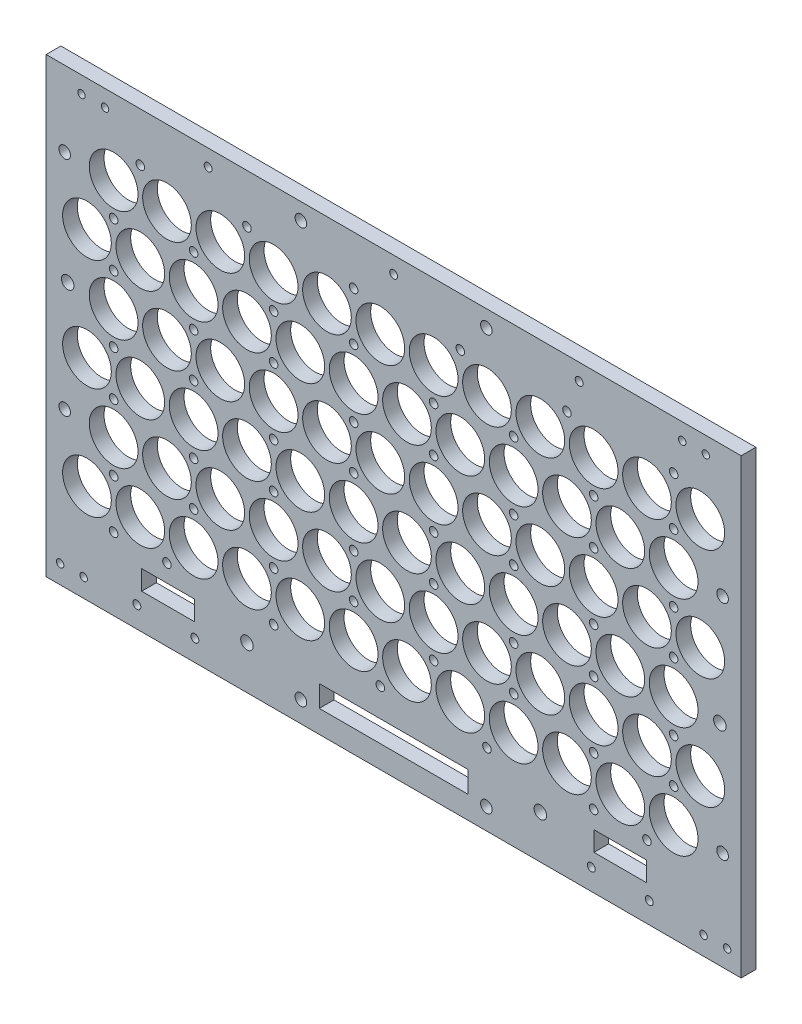
from build123d import *

# Parameters (mm, degrees)
SKETCH1_W                  = 299.700000132
SKETCH1_H                  = 194.250000104
BOSS_EXTRUDE1_DEPTH        = 6.35
SKETCH3_R                  = 10.4988
CUT_EXTRUDE1_DEPTH         = 182.719853184
SKETCH4_R                  = 10.4988
CUT_EXTRUDE2_DEPTH         = 182.719853184
LPATTERN1_COUNT            = 12
LPATTERN1_PITCH            = 23
LPATTERN2_COUNT            = 3
LPATTERN2_PITCH            = 48
LPATTERN2_COPY_1_SKETCH_R  = 10.4988
LPATTERN2_COPY_1_DEPTH     = 182.719853184
LPATTERN2_COPY_2_SKETCH_R  = 10.4988
LPATTERN2_COPY_2_DEPTH     = 182.719853184
LPATTERN2_COPY_3_SKETCH_R  = 10.4988
LPATTERN2_COPY_3_DEPTH     = 182.719853184
LPATTERN2_COPY_4_SKETCH_R  = 10.4988
LPATTERN2_COPY_4_DEPTH     = 182.719853184
LPATTERN2_COPY_5_SKETCH_R  = 10.4988
LPATTERN2_COPY_5_DEPTH     = 182.719853184
LPATTERN2_COPY_6_SKETCH_R  = 10.4988
LPATTERN2_COPY_6_DEPTH     = 182.719853184
LPATTERN2_COPY_7_SKETCH_R  = 10.4988
LPATTERN2_COPY_7_DEPTH     = 182.719853184
LPATTERN2_COPY_8_SKETCH_R  = 10.4988
LPATTERN2_COPY_8_DEPTH     = 182.719853184
LPATTERN2_COPY_9_SKETCH_R  = 10.4988
LPATTERN2_COPY_9_DEPTH     = 182.719853184
LPATTERN2_COPY_10_SKETCH_R = 10.4988
LPATTERN2_COPY_10_DEPTH    = 182.719853184
LPATTERN2_COPY_11_SKETCH_R = 10.4988
LPATTERN2_COPY_11_DEPTH    = 182.719853184
LPATTERN2_COPY_12_SKETCH_R = 10.4988
LPATTERN2_COPY_12_DEPTH    = 182.719853184
LPATTERN2_COPY_13_SKETCH_R = 10.4988
LPATTERN2_COPY_13_DEPTH    = 182.719853184
LPATTERN2_COPY_14_SKETCH_R = 10.4988
LPATTERN2_COPY_14_DEPTH    = 182.719853184
LPATTERN2_COPY_15_SKETCH_R = 10.4988
LPATTERN2_COPY_15_DEPTH    = 182.719853184
LPATTERN2_COPY_16_SKETCH_R = 10.4988
LPATTERN2_COPY_16_DEPTH    = 182.719853184
LPATTERN2_COPY_17_SKETCH_R = 10.4988
LPATTERN2_COPY_17_DEPTH    = 182.719853184
LPATTERN2_COPY_18_SKETCH_R = 10.4988
LPATTERN2_COPY_18_DEPTH    = 182.719853184
LPATTERN2_COPY_19_SKETCH_R = 10.4988
LPATTERN2_COPY_19_DEPTH    = 182.719853184
LPATTERN2_COPY_20_SKETCH_R = 10.4988
LPATTERN2_COPY_20_DEPTH    = 182.719853184
LPATTERN2_COPY_21_SKETCH_R = 10.4988
LPATTERN2_COPY_21_DEPTH    = 182.719853184
LPATTERN2_COPY_22_SKETCH_R = 10.4988
LPATTERN2_COPY_22_DEPTH    = 182.719853184
LPATTERN2_COPY_23_SKETCH_R = 10.4988
LPATTERN2_COPY_23_DEPTH    = 182.719853184
LPATTERN2_COPY_24_SKETCH_R = 10.4988
LPATTERN2_COPY_24_DEPTH    = 182.719853184
LPATTERN2_COPY_25_SKETCH_R = 10.4988
LPATTERN2_COPY_25_DEPTH    = 182.719853184
LPATTERN2_COPY_26_SKETCH_R = 10.4988
LPATTERN2_COPY_26_DEPTH    = 182.719853184
LPATTERN2_COPY_27_SKETCH_R = 10.4988
LPATTERN2_COPY_27_DEPTH    = 182.719853184
LPATTERN2_COPY_28_SKETCH_R = 10.4988
LPATTERN2_COPY_28_DEPTH    = 182.719853184
LPATTERN2_COPY_29_SKETCH_R = 10.4988
LPATTERN2_COPY_29_DEPTH    = 182.719853184
LPATTERN2_COPY_30_SKETCH_R = 10.4988
LPATTERN2_COPY_30_DEPTH    = 182.719853184
LPATTERN2_COPY_31_SKETCH_R = 10.4988
LPATTERN2_COPY_31_DEPTH    = 182.719853184
LPATTERN2_COPY_32_SKETCH_R = 10.4988
LPATTERN2_COPY_32_DEPTH    = 182.719853184
LPATTERN2_COPY_33_SKETCH_R = 10.4988
LPATTERN2_COPY_33_DEPTH    = 182.719853184
LPATTERN2_COPY_34_SKETCH_R = 10.4988
LPATTERN2_COPY_34_DEPTH    = 182.719853184
LPATTERN2_COPY_35_SKETCH_R = 10.4988
LPATTERN2_COPY_35_DEPTH    = 182.719853184
LPATTERN2_COPY_36_SKETCH_R = 10.4988
LPATTERN2_COPY_36_DEPTH    = 182.719853184
LPATTERN2_COPY_37_SKETCH_R = 10.4988
LPATTERN2_COPY_37_DEPTH    = 182.719853184
LPATTERN2_COPY_38_SKETCH_R = 10.4988
LPATTERN2_COPY_38_DEPTH    = 182.719853184
LPATTERN2_COPY_39_SKETCH_R = 10.4988
LPATTERN2_COPY_39_DEPTH    = 182.719853184
LPATTERN2_COPY_40_SKETCH_R = 10.4988
LPATTERN2_COPY_40_DEPTH    = 182.719853184
LPATTERN2_COPY_41_SKETCH_R = 10.4988
LPATTERN2_COPY_41_DEPTH    = 182.719853184
LPATTERN2_COPY_42_SKETCH_R = 10.4988
LPATTERN2_COPY_42_DEPTH    = 182.719853184
LPATTERN2_COPY_43_SKETCH_R = 10.4988
LPATTERN2_COPY_43_DEPTH    = 182.719853184
LPATTERN2_COPY_44_SKETCH_R = 10.4988
LPATTERN2_COPY_44_DEPTH    = 182.719853184
SKETCH5_W                  = 22.76
SKETCH5_H                  = 8.4615
CUT_EXTRUDE3_DEPTH         = 182.719853184
M3_CLEARANCE_HOLE1_D       = 3.2
M3_CLEARANCE_HOLE2_D       = 3.4
SKETCH14_R                 = 2.7
CUT_EXTRUDE4_DEPTH         = 182.719853184
SKETCH15_R                 = 2.5
CUT_EXTRUDE5_DEPTH         = 182.719853184
SKETCH18_R                 = 1.8415
CUT_EXTRUDE7_DEPTH         = 182.719853184
SKETCH19_W                 = 299.700000132
SKETCH19_H                 = 6.35
BOSS_EXTRUDE2_DEPTH        = 0.79375
SKETCH22_R                 = 1.8415
CUT_EXTRUDE8_DEPTH         = 182.719853184
LPATTERN3_COUNT            = 3
LPATTERN3_PITCH            = 48
SKETCH23_R                 = 1.8415
CUT_EXTRUDE9_DEPTH         = 182.719853184
LPATTERN4_COUNT            = 2
LPATTERN4_PITCH            = 48
LPATTERN5_COUNT            = 4
LPATTERN5_PITCH            = 69
LPATTERN5_COPY_1_SKETCH_R  = 1.8415
LPATTERN5_COPY_1_DEPTH     = 182.719853184
LPATTERN5_COPY_2_SKETCH_R  = 1.8415
LPATTERN5_COPY_2_DEPTH     = 182.719853184
LPATTERN5_COPY_3_SKETCH_R  = 1.8415
LPATTERN5_COPY_3_DEPTH     = 182.719853184
LPATTERN5_COPY_4_SKETCH_R  = 1.8415
LPATTERN5_COPY_4_DEPTH     = 182.719853184
LPATTERN5_COPY_5_SKETCH_R  = 1.8415
LPATTERN5_COPY_5_DEPTH     = 182.719853184
LPATTERN5_COPY_6_SKETCH_R  = 1.8415
LPATTERN5_COPY_6_DEPTH     = 182.719853184
LPATTERN5_COPY_7_SKETCH_R  = 1.8415
LPATTERN5_COPY_7_DEPTH     = 182.719853184
LPATTERN5_COPY_8_SKETCH_R  = 1.8415
LPATTERN5_COPY_8_DEPTH     = 182.719853184
LPATTERN5_COPY_9_SKETCH_R  = 1.8415
LPATTERN5_COPY_9_DEPTH     = 182.719853184
M3_CLEARANCE_HOLE3_D       = 3.4
SKETCH31_W                 = 64.135
SKETCH31_H                 = 9.275
CUT_EXTRUDE10_DEPTH        = 182.719853184


with BuildPart() as part:
    # Sketch1 → Boss-Extrude1 (new body)
    with BuildSketch(Plane.XY):
        with Locations((0, -5.475000052)):
            Rectangle(SKETCH1_W, SKETCH1_H)
    extrude(amount=BOSS_EXTRUDE1_DEPTH)

    # Sketch3 → Cut-Extrude1 (cut, through all)
    with BuildSketch(Plane.XY.offset(6.35)):
        with Locations((-132.25, -60)):
            Circle(SKETCH3_R)
    cut_extrude1 = extrude(amount=-CUT_EXTRUDE1_DEPTH, mode=Mode.SUBTRACT)

    # Sketch4 → Cut-Extrude2 (cut, through all)
    with BuildSketch(Plane.XY.offset(6.35)):
        with Locations((-120.75, -36)):
            Circle(SKETCH4_R)
    cut_extrude2 = extrude(amount=-CUT_EXTRUDE2_DEPTH, mode=Mode.SUBTRACT)

    # LPattern1: Cut-Extrude1, Cut-Extrude2 ×12
    with Locations(*[(i * LPATTERN1_PITCH, 0, 0) for i in range(1, LPATTERN1_COUNT)]):
        add(cut_extrude1, mode=Mode.SUBTRACT)
        add(cut_extrude2, mode=Mode.SUBTRACT)

    # LPattern2: Cut-Extrude1, Cut-Extrude2 ×3
    with Locations(*[(0, i * LPATTERN2_PITCH, 0) for i in range(1, LPATTERN2_COUNT)]):
        add(cut_extrude1, mode=Mode.SUBTRACT)
        add(cut_extrude2, mode=Mode.SUBTRACT)

    # LPattern2 copy 1 sketch → LPattern2 copy 1 (cut, through all)
    with BuildSketch(Plane(origin=(23, 48, 6.35), x_dir=(1, 0, 0), z_dir=(0, 0, 1))):
        with Locations((-132.25, -60)):
            Circle(LPATTERN2_COPY_1_SKETCH_R)
    extrude(amount=-LPATTERN2_COPY_1_DEPTH, mode=Mode.SUBTRACT)

    # LPattern2 copy 2 sketch → LPattern2 copy 2 (cut, through all)
    with BuildSketch(Plane(origin=(23, 96, 6.35), x_dir=(1, 0, 0), z_dir=(0, 0, 1))):
        with Locations((-132.25, -60)):
            Circle(LPATTERN2_COPY_2_SKETCH_R)
    extrude(amount=-LPATTERN2_COPY_2_DEPTH, mode=Mode.SUBTRACT)

    # LPattern2 copy 3 sketch → LPattern2 copy 3 (cut, through all)
    with BuildSketch(Plane(origin=(46, 48, 6.35), x_dir=(1, 0, 0), z_dir=(0, 0, 1))):
        with Locations((-132.25, -60)):
            Circle(LPATTERN2_COPY_3_SKETCH_R)
    extrude(amount=-LPATTERN2_COPY_3_DEPTH, mode=Mode.SUBTRACT)

    # LPattern2 copy 4 sketch → LPattern2 copy 4 (cut, through all)
    with BuildSketch(Plane(origin=(46, 96, 6.35), x_dir=(1, 0, 0), z_dir=(0, 0, 1))):
        with Locations((-132.25, -60)):
            Circle(LPATTERN2_COPY_4_SKETCH_R)
    extrude(amount=-LPATTERN2_COPY_4_DEPTH, mode=Mode.SUBTRACT)

    # LPattern2 copy 5 sketch → LPattern2 copy 5 (cut, through all)
    with BuildSketch(Plane(origin=(69, 48, 6.35), x_dir=(1, 0, 0), z_dir=(0, 0, 1))):
        with Locations((-132.25, -60)):
            Circle(LPATTERN2_COPY_5_SKETCH_R)
    extrude(amount=-LPATTERN2_COPY_5_DEPTH, mode=Mode.SUBTRACT)

    # LPattern2 copy 6 sketch → LPattern2 copy 6 (cut, through all)
    with BuildSketch(Plane(origin=(69, 96, 6.35), x_dir=(1, 0, 0), z_dir=(0, 0, 1))):
        with Locations((-132.25, -60)):
            Circle(LPATTERN2_COPY_6_SKETCH_R)
    extrude(amount=-LPATTERN2_COPY_6_DEPTH, mode=Mode.SUBTRACT)

    # LPattern2 copy 7 sketch → LPattern2 copy 7 (cut, through all)
    with BuildSketch(Plane(origin=(92, 48, 6.35), x_dir=(1, 0, 0), z_dir=(0, 0, 1))):
        with Locations((-132.25, -60)):
            Circle(LPATTERN2_COPY_7_SKETCH_R)
    extrude(amount=-LPATTERN2_COPY_7_DEPTH, mode=Mode.SUBTRACT)

    # LPattern2 copy 8 sketch → LPattern2 copy 8 (cut, through all)
    with BuildSketch(Plane(origin=(92, 96, 6.35), x_dir=(1, 0, 0), z_dir=(0, 0, 1))):
        with Locations((-132.25, -60)):
            Circle(LPATTERN2_COPY_8_SKETCH_R)
    extrude(amount=-LPATTERN2_COPY_8_DEPTH, mode=Mode.SUBTRACT)

    # LPattern2 copy 9 sketch → LPattern2 copy 9 (cut, through all)
    with BuildSketch(Plane(origin=(115, 48, 6.35), x_dir=(1, 0, 0), z_dir=(0, 0, 1))):
        with Locations((-132.25, -60)):
            Circle(LPATTERN2_COPY_9_SKETCH_R)
    extrude(amount=-LPATTERN2_COPY_9_DEPTH, mode=Mode.SUBTRACT)

    # LPattern2 copy 10 sketch → LPattern2 copy 10 (cut, through all)
    with BuildSketch(Plane(origin=(115, 96, 6.35), x_dir=(1, 0, 0), z_dir=(0, 0, 1))):
        with Locations((-132.25, -60)):
            Circle(LPATTERN2_COPY_10_SKETCH_R)
    extrude(amount=-LPATTERN2_COPY_10_DEPTH, mode=Mode.SUBTRACT)

    # LPattern2 copy 11 sketch → LPattern2 copy 11 (cut, through all)
    with BuildSketch(Plane(origin=(138, 48, 6.35), x_dir=(1, 0, 0), z_dir=(0, 0, 1))):
        with Locations((-132.25, -60)):
            Circle(LPATTERN2_COPY_11_SKETCH_R)
    extrude(amount=-LPATTERN2_COPY_11_DEPTH, mode=Mode.SUBTRACT)

    # LPattern2 copy 12 sketch → LPattern2 copy 12 (cut, through all)
    with BuildSketch(Plane(origin=(138, 96, 6.35), x_dir=(1, 0, 0), z_dir=(0, 0, 1))):
        with Locations((-132.25, -60)):
            Circle(LPATTERN2_COPY_12_SKETCH_R)
    extrude(amount=-LPATTERN2_COPY_12_DEPTH, mode=Mode.SUBTRACT)

    # LPattern2 copy 13 sketch → LPattern2 copy 13 (cut, through all)
    with BuildSketch(Plane(origin=(161, 48, 6.35), x_dir=(1, 0, 0), z_dir=(0, 0, 1))):
        with Locations((-132.25, -60)):
            Circle(LPATTERN2_COPY_13_SKETCH_R)
    extrude(amount=-LPATTERN2_COPY_13_DEPTH, mode=Mode.SUBTRACT)

    # LPattern2 copy 14 sketch → LPattern2 copy 14 (cut, through all)
    with BuildSketch(Plane(origin=(161, 96, 6.35), x_dir=(1, 0, 0), z_dir=(0, 0, 1))):
        with Locations((-132.25, -60)):
            Circle(LPATTERN2_COPY_14_SKETCH_R)
    extrude(amount=-LPATTERN2_COPY_14_DEPTH, mode=Mode.SUBTRACT)

    # LPattern2 copy 15 sketch → LPattern2 copy 15 (cut, through all)
    with BuildSketch(Plane(origin=(184, 48, 6.35), x_dir=(1, 0, 0), z_dir=(0, 0, 1))):
        with Locations((-132.25, -60)):
            Circle(LPATTERN2_COPY_15_SKETCH_R)
    extrude(amount=-LPATTERN2_COPY_15_DEPTH, mode=Mode.SUBTRACT)

    # LPattern2 copy 16 sketch → LPattern2 copy 16 (cut, through all)
    with BuildSketch(Plane(origin=(184, 96, 6.35), x_dir=(1, 0, 0), z_dir=(0, 0, 1))):
        with Locations((-132.25, -60)):
            Circle(LPATTERN2_COPY_16_SKETCH_R)
    extrude(amount=-LPATTERN2_COPY_16_DEPTH, mode=Mode.SUBTRACT)

    # LPattern2 copy 17 sketch → LPattern2 copy 17 (cut, through all)
    with BuildSketch(Plane(origin=(207, 48, 6.35), x_dir=(1, 0, 0), z_dir=(0, 0, 1))):
        with Locations((-132.25, -60)):
            Circle(LPATTERN2_COPY_17_SKETCH_R)
    extrude(amount=-LPATTERN2_COPY_17_DEPTH, mode=Mode.SUBTRACT)

    # LPattern2 copy 18 sketch → LPattern2 copy 18 (cut, through all)
    with BuildSketch(Plane(origin=(207, 96, 6.35), x_dir=(1, 0, 0), z_dir=(0, 0, 1))):
        with Locations((-132.25, -60)):
            Circle(LPATTERN2_COPY_18_SKETCH_R)
    extrude(amount=-LPATTERN2_COPY_18_DEPTH, mode=Mode.SUBTRACT)

    # LPattern2 copy 19 sketch → LPattern2 copy 19 (cut, through all)
    with BuildSketch(Plane(origin=(230, 48, 6.35), x_dir=(1, 0, 0), z_dir=(0, 0, 1))):
        with Locations((-132.25, -60)):
            Circle(LPATTERN2_COPY_19_SKETCH_R)
    extrude(amount=-LPATTERN2_COPY_19_DEPTH, mode=Mode.SUBTRACT)

    # LPattern2 copy 20 sketch → LPattern2 copy 20 (cut, through all)
    with BuildSketch(Plane(origin=(230, 96, 6.35), x_dir=(1, 0, 0), z_dir=(0, 0, 1))):
        with Locations((-132.25, -60)):
            Circle(LPATTERN2_COPY_20_SKETCH_R)
    extrude(amount=-LPATTERN2_COPY_20_DEPTH, mode=Mode.SUBTRACT)

    # LPattern2 copy 21 sketch → LPattern2 copy 21 (cut, through all)
    with BuildSketch(Plane(origin=(253, 48, 6.35), x_dir=(1, 0, 0), z_dir=(0, 0, 1))):
        with Locations((-132.25, -60)):
            Circle(LPATTERN2_COPY_21_SKETCH_R)
    extrude(amount=-LPATTERN2_COPY_21_DEPTH, mode=Mode.SUBTRACT)

    # LPattern2 copy 22 sketch → LPattern2 copy 22 (cut, through all)
    with BuildSketch(Plane(origin=(253, 96, 6.35), x_dir=(1, 0, 0), z_dir=(0, 0, 1))):
        with Locations((-132.25, -60)):
            Circle(LPATTERN2_COPY_22_SKETCH_R)
    extrude(amount=-LPATTERN2_COPY_22_DEPTH, mode=Mode.SUBTRACT)

    # LPattern2 copy 23 sketch → LPattern2 copy 23 (cut, through all)
    with BuildSketch(Plane(origin=(23, 48, 6.35), x_dir=(1, 0, 0), z_dir=(0, 0, 1))):
        with Locations((-120.75, -36)):
            Circle(LPATTERN2_COPY_23_SKETCH_R)
    extrude(amount=-LPATTERN2_COPY_23_DEPTH, mode=Mode.SUBTRACT)

    # LPattern2 copy 24 sketch → LPattern2 copy 24 (cut, through all)
    with BuildSketch(Plane(origin=(23, 96, 6.35), x_dir=(1, 0, 0), z_dir=(0, 0, 1))):
        with Locations((-120.75, -36)):
            Circle(LPATTERN2_COPY_24_SKETCH_R)
    extrude(amount=-LPATTERN2_COPY_24_DEPTH, mode=Mode.SUBTRACT)

    # LPattern2 copy 25 sketch → LPattern2 copy 25 (cut, through all)
    with BuildSketch(Plane(origin=(46, 48, 6.35), x_dir=(1, 0, 0), z_dir=(0, 0, 1))):
        with Locations((-120.75, -36)):
            Circle(LPATTERN2_COPY_25_SKETCH_R)
    extrude(amount=-LPATTERN2_COPY_25_DEPTH, mode=Mode.SUBTRACT)

    # LPattern2 copy 26 sketch → LPattern2 copy 26 (cut, through all)
    with BuildSketch(Plane(origin=(46, 96, 6.35), x_dir=(1, 0, 0), z_dir=(0, 0, 1))):
        with Locations((-120.75, -36)):
            Circle(LPATTERN2_COPY_26_SKETCH_R)
    extrude(amount=-LPATTERN2_COPY_26_DEPTH, mode=Mode.SUBTRACT)

    # LPattern2 copy 27 sketch → LPattern2 copy 27 (cut, through all)
    with BuildSketch(Plane(origin=(69, 48, 6.35), x_dir=(1, 0, 0), z_dir=(0, 0, 1))):
        with Locations((-120.75, -36)):
            Circle(LPATTERN2_COPY_27_SKETCH_R)
    extrude(amount=-LPATTERN2_COPY_27_DEPTH, mode=Mode.SUBTRACT)

    # LPattern2 copy 28 sketch → LPattern2 copy 28 (cut, through all)
    with BuildSketch(Plane(origin=(69, 96, 6.35), x_dir=(1, 0, 0), z_dir=(0, 0, 1))):
        with Locations((-120.75, -36)):
            Circle(LPATTERN2_COPY_28_SKETCH_R)
    extrude(amount=-LPATTERN2_COPY_28_DEPTH, mode=Mode.SUBTRACT)

    # LPattern2 copy 29 sketch → LPattern2 copy 29 (cut, through all)
    with BuildSketch(Plane(origin=(92, 48, 6.35), x_dir=(1, 0, 0), z_dir=(0, 0, 1))):
        with Locations((-120.75, -36)):
            Circle(LPATTERN2_COPY_29_SKETCH_R)
    extrude(amount=-LPATTERN2_COPY_29_DEPTH, mode=Mode.SUBTRACT)

    # LPattern2 copy 30 sketch → LPattern2 copy 30 (cut, through all)
    with BuildSketch(Plane(origin=(92, 96, 6.35), x_dir=(1, 0, 0), z_dir=(0, 0, 1))):
        with Locations((-120.75, -36)):
            Circle(LPATTERN2_COPY_30_SKETCH_R)
    extrude(amount=-LPATTERN2_COPY_30_DEPTH, mode=Mode.SUBTRACT)

    # LPattern2 copy 31 sketch → LPattern2 copy 31 (cut, through all)
    with BuildSketch(Plane(origin=(115, 48, 6.35), x_dir=(1, 0, 0), z_dir=(0, 0, 1))):
        with Locations((-120.75, -36)):
            Circle(LPATTERN2_COPY_31_SKETCH_R)
    extrude(amount=-LPATTERN2_COPY_31_DEPTH, mode=Mode.SUBTRACT)

    # LPattern2 copy 32 sketch → LPattern2 copy 32 (cut, through all)
    with BuildSketch(Plane(origin=(115, 96, 6.35), x_dir=(1, 0, 0), z_dir=(0, 0, 1))):
        with Locations((-120.75, -36)):
            Circle(LPATTERN2_COPY_32_SKETCH_R)
    extrude(amount=-LPATTERN2_COPY_32_DEPTH, mode=Mode.SUBTRACT)

    # LPattern2 copy 33 sketch → LPattern2 copy 33 (cut, through all)
    with BuildSketch(Plane(origin=(138, 48, 6.35), x_dir=(1, 0, 0), z_dir=(0, 0, 1))):
        with Locations((-120.75, -36)):
            Circle(LPATTERN2_COPY_33_SKETCH_R)
    extrude(amount=-LPATTERN2_COPY_33_DEPTH, mode=Mode.SUBTRACT)

    # LPattern2 copy 34 sketch → LPattern2 copy 34 (cut, through all)
    with BuildSketch(Plane(origin=(138, 96, 6.35), x_dir=(1, 0, 0), z_dir=(0, 0, 1))):
        with Locations((-120.75, -36)):
            Circle(LPATTERN2_COPY_34_SKETCH_R)
    extrude(amount=-LPATTERN2_COPY_34_DEPTH, mode=Mode.SUBTRACT)

    # LPattern2 copy 35 sketch → LPattern2 copy 35 (cut, through all)
    with BuildSketch(Plane(origin=(161, 48, 6.35), x_dir=(1, 0, 0), z_dir=(0, 0, 1))):
        with Locations((-120.75, -36)):
            Circle(LPATTERN2_COPY_35_SKETCH_R)
    extrude(amount=-LPATTERN2_COPY_35_DEPTH, mode=Mode.SUBTRACT)

    # LPattern2 copy 36 sketch → LPattern2 copy 36 (cut, through all)
    with BuildSketch(Plane(origin=(161, 96, 6.35), x_dir=(1, 0, 0), z_dir=(0, 0, 1))):
        with Locations((-120.75, -36)):
            Circle(LPATTERN2_COPY_36_SKETCH_R)
    extrude(amount=-LPATTERN2_COPY_36_DEPTH, mode=Mode.SUBTRACT)

    # LPattern2 copy 37 sketch → LPattern2 copy 37 (cut, through all)
    with BuildSketch(Plane(origin=(184, 48, 6.35), x_dir=(1, 0, 0), z_dir=(0, 0, 1))):
        with Locations((-120.75, -36)):
            Circle(LPATTERN2_COPY_37_SKETCH_R)
    extrude(amount=-LPATTERN2_COPY_37_DEPTH, mode=Mode.SUBTRACT)

    # LPattern2 copy 38 sketch → LPattern2 copy 38 (cut, through all)
    with BuildSketch(Plane(origin=(184, 96, 6.35), x_dir=(1, 0, 0), z_dir=(0, 0, 1))):
        with Locations((-120.75, -36)):
            Circle(LPATTERN2_COPY_38_SKETCH_R)
    extrude(amount=-LPATTERN2_COPY_38_DEPTH, mode=Mode.SUBTRACT)

    # LPattern2 copy 39 sketch → LPattern2 copy 39 (cut, through all)
    with BuildSketch(Plane(origin=(207, 48, 6.35), x_dir=(1, 0, 0), z_dir=(0, 0, 1))):
        with Locations((-120.75, -36)):
            Circle(LPATTERN2_COPY_39_SKETCH_R)
    extrude(amount=-LPATTERN2_COPY_39_DEPTH, mode=Mode.SUBTRACT)

    # LPattern2 copy 40 sketch → LPattern2 copy 40 (cut, through all)
    with BuildSketch(Plane(origin=(207, 96, 6.35), x_dir=(1, 0, 0), z_dir=(0, 0, 1))):
        with Locations((-120.75, -36)):
            Circle(LPATTERN2_COPY_40_SKETCH_R)
    extrude(amount=-LPATTERN2_COPY_40_DEPTH, mode=Mode.SUBTRACT)

    # LPattern2 copy 41 sketch → LPattern2 copy 41 (cut, through all)
    with BuildSketch(Plane(origin=(230, 48, 6.35), x_dir=(1, 0, 0), z_dir=(0, 0, 1))):
        with Locations((-120.75, -36)):
            Circle(LPATTERN2_COPY_41_SKETCH_R)
    extrude(amount=-LPATTERN2_COPY_41_DEPTH, mode=Mode.SUBTRACT)

    # LPattern2 copy 42 sketch → LPattern2 copy 42 (cut, through all)
    with BuildSketch(Plane(origin=(230, 96, 6.35), x_dir=(1, 0, 0), z_dir=(0, 0, 1))):
        with Locations((-120.75, -36)):
            Circle(LPATTERN2_COPY_42_SKETCH_R)
    extrude(amount=-LPATTERN2_COPY_42_DEPTH, mode=Mode.SUBTRACT)

    # LPattern2 copy 43 sketch → LPattern2 copy 43 (cut, through all)
    with BuildSketch(Plane(origin=(253, 48, 6.35), x_dir=(1, 0, 0), z_dir=(0, 0, 1))):
        with Locations((-120.75, -36)):
            Circle(LPATTERN2_COPY_43_SKETCH_R)
    extrude(amount=-LPATTERN2_COPY_43_DEPTH, mode=Mode.SUBTRACT)

    # LPattern2 copy 44 sketch → LPattern2 copy 44 (cut, through all)
    with BuildSketch(Plane(origin=(253, 96, 6.35), x_dir=(1, 0, 0), z_dir=(0, 0, 1))):
        with Locations((-120.75, -36)):
            Circle(LPATTERN2_COPY_44_SKETCH_R)
    extrude(amount=-LPATTERN2_COPY_44_DEPTH, mode=Mode.SUBTRACT)

    # Sketch5 → Cut-Extrude3 (cut, through all)
    # profile 1 of 4: a face of its own
    with BuildSketch(Plane.XY.offset(6.35)):
        with Locations((97.75, -83.18075)):
            Rectangle(SKETCH5_W, SKETCH5_H)
        with BuildLine():
            Line((90.18464302, -79.3475), (105.31535698, -79.3475))
            ThreePointArc((105.31535698, -79.3475), (105.176769839, -79.814816153), (105.13, -80.3))
            Line((105.13, -80.3), (105.13, -83.4115))
            Line((105.13, -83.4115), (90.37, -83.4115))
            Line((90.37, -83.4115), (90.37, -80.3))
            ThreePointArc((90.37, -80.3), (90.323230161, -79.814816153), (90.18464302, -79.3475))
        make_face(mode=Mode.SUBTRACT)
    # profile 2 of 4: a face of its own
    with BuildSketch(Plane.XY.offset(6.35)):
        with BuildLine():
            ThreePointArc((105.31535698, -79.3475), (105.176769839, -79.814816153), (105.13, -80.3))
            Line((105.13, -80.3), (105.13, -83.4115))
            Line((105.13, -83.4115), (90.37, -83.4115))
            Line((90.37, -83.4115), (90.37, -80.3))
            ThreePointArc((90.37, -80.3), (90.323230161, -79.814816153), (90.18464302, -79.3475))
            Line((90.18464302, -79.3475), (105.31535698, -79.3475))
        make_face()
    # profile 3 of 4: a face of its own
    with BuildSketch(Plane.XY.offset(6.35)):
        with Locations((-97.288, -83.18075)):
            Rectangle(SKETCH5_W, SKETCH5_H)
        with BuildLine():
            Line((-104.85335698, -79.3475), (-89.72264302, -79.3475))
            ThreePointArc((-89.72264302, -79.3475), (-89.861230161, -79.814816153), (-89.908, -80.3))
            Line((-89.908, -80.3), (-89.908, -83.4115))
            Line((-89.908, -83.4115), (-104.668, -83.4115))
            Line((-104.668, -83.4115), (-104.668, -80.3))
            ThreePointArc((-104.668, -80.3), (-104.714769839, -79.814816153), (-104.85335698, -79.3475))
        make_face(mode=Mode.SUBTRACT)
    # profile 4 of 4: a face of its own
    with BuildSketch(Plane.XY.offset(6.35)):
        with BuildLine():
            ThreePointArc((-89.72264302, -79.3475), (-89.861230161, -79.814816153), (-89.908, -80.3))
            Line((-89.908, -80.3), (-89.908, -83.4115))
            Line((-89.908, -83.4115), (-104.668, -83.4115))
            Line((-104.668, -83.4115), (-104.668, -80.3))
            ThreePointArc((-104.668, -80.3), (-104.714769839, -79.814816153), (-104.85335698, -79.3475))
            Line((-104.85335698, -79.3475), (-89.72264302, -79.3475))
        make_face()
    extrude(amount=-CUT_EXTRUDE3_DEPTH, mode=Mode.SUBTRACT)

    # M3 Clearance Hole1 (through all)
    with Locations(Plane.XY.offset(6.35)):
        with Locations((124.450000066, 85.3), (134.610000066, 85.3), (-124.450000066, 85.3), (-134.610000066, 85.3), (-143.817500066, -94.6000001), (-133.657500066, -94.6000001), (133.657500066, -94.6000001), (143.817500066, -94.6000001)):
            Hole(M3_CLEARANCE_HOLE1_D / 2)

    # M3 Clearance Hole2 (through all)
    with Locations(Plane.XY.offset(6.35)):
        with Locations((110.25, -93.50575), (85.25, -93.50575), (-80, 85.3), (0, 85.3), (80, 85.3)):
            Hole(M3_CLEARANCE_HOLE2_D / 2)

    # Sketch14 → Cut-Extrude4 (cut, through all)
    with BuildSketch(Plane.XY.offset(6.35)):
        with Locations((-63.25, -83.95)):
            Circle(SKETCH14_R)
        with Locations((63.25, -83.95)):
            Circle(SKETCH14_R)
        with Locations((-140.549400033, 12)):
            Circle(SKETCH14_R)
        with Locations((140.687500033, -12)):
            Circle(SKETCH14_R)
    extrude(amount=-CUT_EXTRUDE4_DEPTH, mode=Mode.SUBTRACT)

    # Sketch15 → Cut-Extrude5 (cut, through all)
    with BuildSketch(Plane.XY.offset(6.35)):
        with Locations((-40, 85.3)):
            Circle(SKETCH15_R)
        with Locations((40, 85.3)):
            Circle(SKETCH15_R)
        with Locations((141.850000066, 36)):
            Circle(SKETCH15_R)
        with Locations((141.850000066, -60)):
            Circle(SKETCH15_R)
        with Locations((-141.850000066, -36)):
            Circle(SKETCH15_R)
        with Locations((-141.850000066, 60)):
            Circle(SKETCH15_R)
        with Locations((-40, -93.50575)):
            Circle(SKETCH15_R)
        with Locations((40, -93.50575)):
            Circle(SKETCH15_R)
    extrude(amount=-CUT_EXTRUDE5_DEPTH, mode=Mode.SUBTRACT)

    # Sketch18 → Cut-Extrude7 (cut, through all)
    with BuildSketch(Plane.XY.offset(6.35)):
        with Locations((109.25, -71.41)):
            Circle(SKETCH18_R)
        with Locations((86.25, -71.41)):
            Circle(SKETCH18_R)
        with Locations((120.75, 71.41)):
            Circle(SKETCH18_R)
        with Locations((74.75, 71.41)):
            Circle(SKETCH18_R)
        with Locations((28.75, 71.41)):
            Circle(SKETCH18_R)
        with Locations((-17.25, 71.41)):
            Circle(SKETCH18_R)
        with Locations((-63.25, 71.41)):
            Circle(SKETCH18_R)
        with Locations((-109.25, 71.41)):
            Circle(SKETCH18_R)
        with Locations((40.25, -71.41)):
            Circle(SKETCH18_R)
        with Locations((-5.75, -71.41)):
            Circle(SKETCH18_R)
        with Locations((-51.75, -71.41)):
            Circle(SKETCH18_R)
        with Locations((-97.75, -71.41)):
            Circle(SKETCH18_R)
        with Locations((-120.75, -71.41)):
            Circle(SKETCH18_R)
    extrude(amount=-CUT_EXTRUDE7_DEPTH, mode=Mode.SUBTRACT)

    # Sketch19 → Boss-Extrude2 (add)
    with BuildSketch(Plane(origin=(0, 91.65, 0), x_dir=(1, 0, 0), z_dir=(0, 1, 0))):
        with Locations((0, -3.175)):
            Rectangle(SKETCH19_W, SKETCH19_H)
    extrude(amount=BOSS_EXTRUDE2_DEPTH)

    # Sketch22 → Cut-Extrude8 (cut, through all)
    with BuildSketch(Plane.XY.offset(6.35)):
        with Locations((120.75, -45.467986122)):
            Circle(SKETCH22_R)
        with Locations((86.25, -50.28293229)):
            Circle(SKETCH22_R)
    cut_extrude8 = extrude(amount=-CUT_EXTRUDE8_DEPTH, mode=Mode.SUBTRACT)

    # LPattern3: Cut-Extrude8 ×3
    with Locations(*[(0, i * LPATTERN3_PITCH, 0) for i in range(1, LPATTERN3_COUNT)]):
        add(cut_extrude8, mode=Mode.SUBTRACT)

    # Sketch23 → Cut-Extrude9 (cut, through all)
    with BuildSketch(Plane.XY.offset(6.35)):
        with Locations((86.25, -21.71706771)):
            Circle(SKETCH23_R)
        with Locations((120.75, -26.532013878)):
            Circle(SKETCH23_R)
    cut_extrude9 = extrude(amount=-CUT_EXTRUDE9_DEPTH, mode=Mode.SUBTRACT)

    # LPattern4: Cut-Extrude9 ×2
    with Locations(*[(0, i * LPATTERN4_PITCH, 0) for i in range(1, LPATTERN4_COUNT)]):
        add(cut_extrude9, mode=Mode.SUBTRACT)

    # LPattern5: Cut-Extrude8, Cut-Extrude9 ×4
    with Locations(*[(-i * LPATTERN5_PITCH, 0, 0) for i in range(1, LPATTERN5_COUNT)]):
        add(cut_extrude8, mode=Mode.SUBTRACT)
        add(cut_extrude9, mode=Mode.SUBTRACT)

    # LPattern5 copy 1 sketch → LPattern5 copy 1 (cut, through all)
    with BuildSketch(Plane(origin=(-69, 48, 6.35), x_dir=(1, 0, 0), z_dir=(0, 0, 1))):
        with Locations((120.75, -45.467986122)):
            Circle(LPATTERN5_COPY_1_SKETCH_R)
        with Locations((86.25, -50.28293229)):
            Circle(LPATTERN5_COPY_1_SKETCH_R)
    extrude(amount=-LPATTERN5_COPY_1_DEPTH, mode=Mode.SUBTRACT)

    # LPattern5 copy 2 sketch → LPattern5 copy 2 (cut, through all)
    with BuildSketch(Plane(origin=(-138, 48, 6.35), x_dir=(1, 0, 0), z_dir=(0, 0, 1))):
        with Locations((120.75, -45.467986122)):
            Circle(LPATTERN5_COPY_2_SKETCH_R)
        with Locations((86.25, -50.28293229)):
            Circle(LPATTERN5_COPY_2_SKETCH_R)
    extrude(amount=-LPATTERN5_COPY_2_DEPTH, mode=Mode.SUBTRACT)

    # LPattern5 copy 3 sketch → LPattern5 copy 3 (cut, through all)
    with BuildSketch(Plane(origin=(-207, 48, 6.35), x_dir=(1, 0, 0), z_dir=(0, 0, 1))):
        with Locations((120.75, -45.467986122)):
            Circle(LPATTERN5_COPY_3_SKETCH_R)
        with Locations((86.25, -50.28293229)):
            Circle(LPATTERN5_COPY_3_SKETCH_R)
    extrude(amount=-LPATTERN5_COPY_3_DEPTH, mode=Mode.SUBTRACT)

    # LPattern5 copy 4 sketch → LPattern5 copy 4 (cut, through all)
    with BuildSketch(Plane(origin=(-69, 96, 6.35), x_dir=(1, 0, 0), z_dir=(0, 0, 1))):
        with Locations((120.75, -45.467986122)):
            Circle(LPATTERN5_COPY_4_SKETCH_R)
        with Locations((86.25, -50.28293229)):
            Circle(LPATTERN5_COPY_4_SKETCH_R)
    extrude(amount=-LPATTERN5_COPY_4_DEPTH, mode=Mode.SUBTRACT)

    # LPattern5 copy 5 sketch → LPattern5 copy 5 (cut, through all)
    with BuildSketch(Plane(origin=(-138, 96, 6.35), x_dir=(1, 0, 0), z_dir=(0, 0, 1))):
        with Locations((120.75, -45.467986122)):
            Circle(LPATTERN5_COPY_5_SKETCH_R)
        with Locations((86.25, -50.28293229)):
            Circle(LPATTERN5_COPY_5_SKETCH_R)
    extrude(amount=-LPATTERN5_COPY_5_DEPTH, mode=Mode.SUBTRACT)

    # LPattern5 copy 6 sketch → LPattern5 copy 6 (cut, through all)
    with BuildSketch(Plane(origin=(-207, 96, 6.35), x_dir=(1, 0, 0), z_dir=(0, 0, 1))):
        with Locations((120.75, -45.467986122)):
            Circle(LPATTERN5_COPY_6_SKETCH_R)
        with Locations((86.25, -50.28293229)):
            Circle(LPATTERN5_COPY_6_SKETCH_R)
    extrude(amount=-LPATTERN5_COPY_6_DEPTH, mode=Mode.SUBTRACT)

    # LPattern5 copy 7 sketch → LPattern5 copy 7 (cut, through all)
    with BuildSketch(Plane(origin=(-69, 48, 6.35), x_dir=(1, 0, 0), z_dir=(0, 0, 1))):
        with Locations((86.25, -21.71706771)):
            Circle(LPATTERN5_COPY_7_SKETCH_R)
        with Locations((120.75, -26.532013878)):
            Circle(LPATTERN5_COPY_7_SKETCH_R)
    extrude(amount=-LPATTERN5_COPY_7_DEPTH, mode=Mode.SUBTRACT)

    # LPattern5 copy 8 sketch → LPattern5 copy 8 (cut, through all)
    with BuildSketch(Plane(origin=(-138, 48, 6.35), x_dir=(1, 0, 0), z_dir=(0, 0, 1))):
        with Locations((86.25, -21.71706771)):
            Circle(LPATTERN5_COPY_8_SKETCH_R)
        with Locations((120.75, -26.532013878)):
            Circle(LPATTERN5_COPY_8_SKETCH_R)
    extrude(amount=-LPATTERN5_COPY_8_DEPTH, mode=Mode.SUBTRACT)

    # LPattern5 copy 9 sketch → LPattern5 copy 9 (cut, through all)
    with BuildSketch(Plane(origin=(-207, 48, 6.35), x_dir=(1, 0, 0), z_dir=(0, 0, 1))):
        with Locations((86.25, -21.71706771)):
            Circle(LPATTERN5_COPY_9_SKETCH_R)
        with Locations((120.75, -26.532013878)):
            Circle(LPATTERN5_COPY_9_SKETCH_R)
    extrude(amount=-LPATTERN5_COPY_9_DEPTH, mode=Mode.SUBTRACT)

    # M3 Clearance Hole3 (through all)
    with Locations(Plane.XY.offset(6.35)):
        with Locations((-85.712000066, -93.485979104), (-110.712000066, -93.485979104)):
            Hole(M3_CLEARANCE_HOLE3_D / 2)

    # Sketch31 → Cut-Extrude10 (cut, through all)
    with BuildSketch(Plane.XY.offset(6.35)):
        with Locations((0, -88.236252104)):
            Rectangle(SKETCH31_W, SKETCH31_H)
    extrude(amount=-CUT_EXTRUDE10_DEPTH, mode=Mode.SUBTRACT)


solid = part.part
